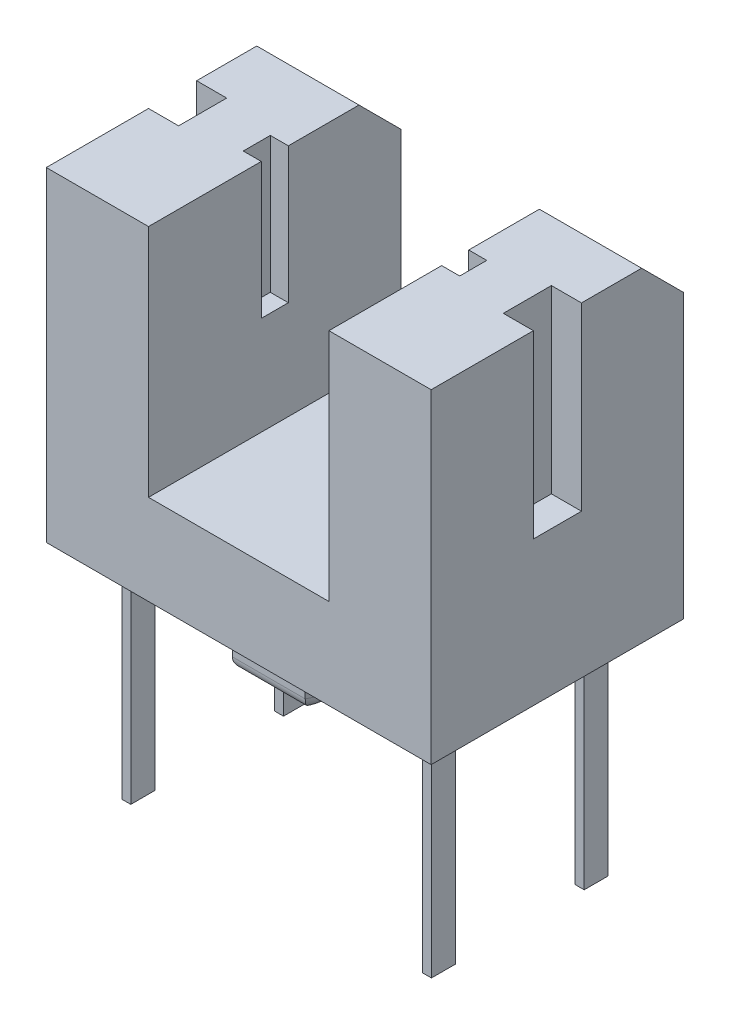
from build123d import *

# Parameters (mm, degrees)
SKETCH2_W           = 6.4
SKETCH2_H           = 4.2
BOSS_EXTRUDE1_DEPTH = 1.5
SKETCH3_W           = 1.7
SKETCH3_H           = 4.2
BOSS_EXTRUDE2_DEPTH = 3.9
SKETCH4_W           = 0.15
SKETCH4_H           = 0.4
BOSS_EXTRUDE3_DEPTH = 3.7
BOSS_EXTRUDE4_DEPTH = 0.8
FILLET1_R           = 0.2
FILLET2_R           = 0.1
SKETCH6_W           = 0.45
SKETCH6_H           = 2.26
CUT_EXTRUDE1_DEPTH  = 0.3
SKETCH7_W           = 0.8
SKETCH7_H           = 3
CUT_EXTRUDE2_DEPTH  = 0.5
CHAMFER3_SIZE       = 0.7


with BuildPart() as part:
    # Sketch2 → Boss-Extrude1 (new body)
    with BuildSketch(Plane(origin=(0, 0, 0), x_dir=(1, 0, 0), z_dir=(0, 1, 0))):
        Rectangle(SKETCH2_W, SKETCH2_H)
    extrude(amount=BOSS_EXTRUDE1_DEPTH)

    # Sketch3 → Boss-Extrude2 (add)
    with BuildSketch(Plane(origin=(0, 1.5, 0), x_dir=(1, 0, 0), z_dir=(0, 1, 0))):
        with Locations((-2.35, 0)):
            Rectangle(SKETCH3_W, SKETCH3_H)
        with Locations((2.35, 0)):
            Rectangle(SKETCH3_W, SKETCH3_H)
    extrude(amount=BOSS_EXTRUDE2_DEPTH)

    # Sketch4 → Boss-Extrude3 (add)
    with BuildSketch(Plane.XZ):
        with Locations((2.5, 1.27)):
            Rectangle(SKETCH4_W, SKETCH4_H)
        with Locations((-2.5, 1.27)):
            Rectangle(SKETCH4_W, SKETCH4_H)
        with Locations((2.5, -1.27)):
            Rectangle(SKETCH4_W, SKETCH4_H)
        with Locations((-2.5, -1.27)):
            Rectangle(SKETCH4_W, SKETCH4_H)
    extrude(amount=BOSS_EXTRUDE3_DEPTH)

    # Sketch5 → Boss-Extrude4 (add)
    with BuildSketch(Plane.XZ):
        with BuildLine():
            Line((-0.606217783, 1.6), (0.606217783, 1.6))
            ThreePointArc((0.606217783, 1.6), (0, 0.55), (-0.606217783, 1.6))
        make_face()
        with BuildLine():
            Line((-0.357071421, -1.6), (0.357071421, -1.6))
            ThreePointArc((0.357071421, -1.6), (0, -0.75), (-0.357071421, -1.6))
        make_face()
    extrude(amount=BOSS_EXTRUDE4_DEPTH)

    # Fillet1
    fillet1_edges = [part.edges().sort_by_distance(p)[0] for p in [
        (0, -0.8, 0.55),
        (0, -0.8, 1.6),
    ]]
    fillet(fillet1_edges, radius=FILLET1_R)

    # Fillet2
    fillet2_edges = [part.edges().sort_by_distance(p)[0] for p in [
        (0, -0.8, -0.75),
        (0, -0.8, -1.6),
    ]]
    fillet(fillet2_edges, radius=FILLET2_R)

    # Sketch6 → Cut-Extrude1 (cut)
    with BuildSketch(Plane(origin=(-1.5, 0, 0), x_dir=(0, 0, -1), z_dir=(1, 0, 0))):
        with Locations((0, 4.27)):
            Rectangle(SKETCH6_W, SKETCH6_H)
    cut_extrude1 = extrude(amount=-CUT_EXTRUDE1_DEPTH, mode=Mode.SUBTRACT)

    # Sketch7 → Cut-Extrude2 (cut)
    with BuildSketch(Plane.ZY.offset(3.2)):
        with Locations((0, 3.9)):
            Rectangle(SKETCH7_W, SKETCH7_H)
    cut_extrude2 = extrude(amount=-CUT_EXTRUDE2_DEPTH, mode=Mode.SUBTRACT)

    # Chamfer3
    chamfer3_edges = [part.edges().sort_by_distance(p)[0] for p in [
        (2.35, 5.4, -2.1),
        (-2.35, 5.4, -2.1),
    ]]
    chamfer(chamfer3_edges, length=CHAMFER3_SIZE)

    # Mirror5: Cut-Extrude1, Cut-Extrude2 across plane
    add(cut_extrude1.mirror(Plane(origin=(0, 0, 0), x_dir=(0, 0, 1), z_dir=(1, 0, 0))), mode=Mode.SUBTRACT)
    add(cut_extrude2.mirror(Plane(origin=(0, 0, 0), x_dir=(0, 0, 1), z_dir=(1, 0, 0))), mode=Mode.SUBTRACT)


solid = part.part
